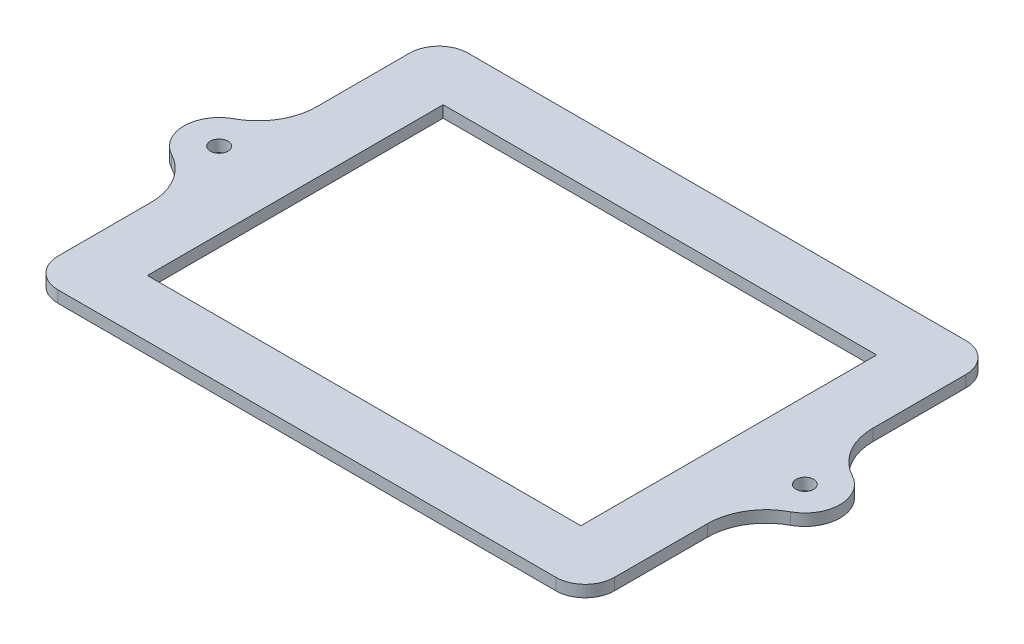
from build123d import *

# Parameters (mm, degrees)
SKETCH2_R           = 1.5
SKETCH2_W           = 74
SKETCH2_H           = 50.5
BOSS_EXTRUDE1_DEPTH = 2
FILLET1_R           = 5
FILLET2_R           = 10


with BuildPart() as part:
    # Sketch2 → Boss-Extrude1 (new body)
    with BuildSketch(Plane(origin=(0, 0, 0), x_dir=(1, 0, 0), z_dir=(0, 1, 0))):
        with BuildLine():
            Line((-47.5, 35), (47.5, 35))
            Line((47.5, 35), (47.5, 5.454356057))
            ThreePointArc((47.5, 5.454356057), (56, 0), (47.5, -5.454356057))
            Line((47.5, -5.454356057), (47.5, -35))
            Line((47.5, -35), (-47.5, -35))
            Line((-47.5, -35), (-47.5, -5.454356057))
            ThreePointArc((-47.5, -5.454356057), (-56, 0), (-47.5, 5.454356057))
            Line((-47.5, 5.454356057), (-47.5, 35))
        make_face()
        with Locations(Location((-50, 0, 0), (0, 0, 270))):
            Circle(SKETCH2_R, mode=Mode.SUBTRACT)
        with Locations(Location((50, 0, 0), (0, 0, 270))):
            Circle(SKETCH2_R, mode=Mode.SUBTRACT)
        Rectangle(SKETCH2_W, SKETCH2_H, mode=Mode.SUBTRACT)
    extrude(amount=BOSS_EXTRUDE1_DEPTH)

    # Fillet1
    fillet1_edges = [part.edges().sort_by_distance(p)[0] for p in [
        (-47.5, 1, -35),
        (47.5, 1, -35),
        (47.5, 1, 35),
        (-47.5, 1, 35),
    ]]
    fillet(fillet1_edges, radius=FILLET1_R)

    # Fillet2
    fillet2_edges = [part.edges().sort_by_distance(p)[0] for p in [
        (47.5, 1, -5.454356057),
        (47.5, 1, 5.454356057),
        (-47.5, 1, 5.454356057),
        (-47.5, 1, -5.454356057),
    ]]
    fillet(fillet2_edges, radius=FILLET2_R)


solid = part.part
